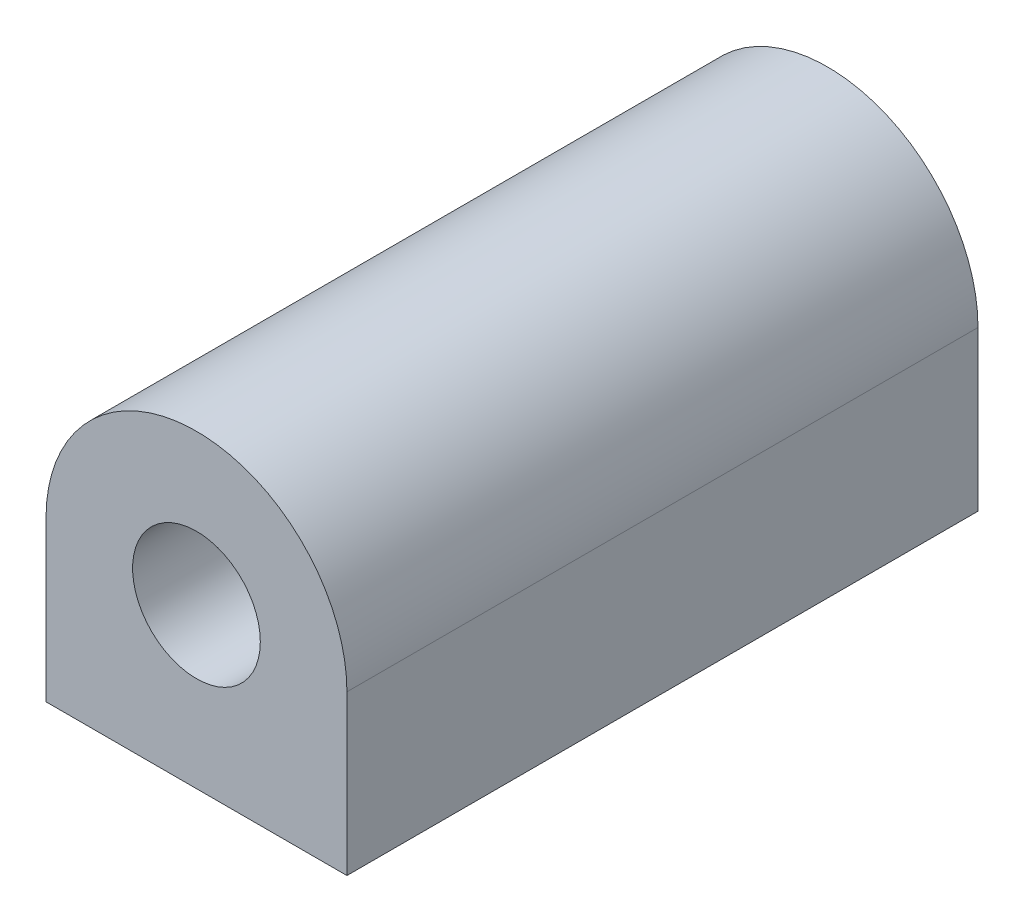
from build123d import *

# Parameters (mm, degrees)
SKETCH2_R           = 3.475
BOSS_EXTRUDE2_DEPTH = 14.575
SKETCH3_R           = 1.475
CUT_EXTRUDE1_DEPTH  = 10
CUT_EXTRUDE2_START  = -10
SKETCH4_R           = 1.475
CUT_EXTRUDE2_DEPTH  = 10
BOSS_EXTRUDE3_DEPTH = 14.575
SKETCH6_W           = 6.95
SKETCH6_H           = 14.575
BOSS_EXTRUDE4_DEPTH = 0.2


with BuildPart() as part:
    # Sketch2 → Boss-Extrude2 (new body)
    with BuildSketch(Plane.XY):
        Circle(SKETCH2_R)
    extrude(amount=BOSS_EXTRUDE2_DEPTH)

    # Sketch3 → Cut-Extrude1 (cut)
    with BuildSketch(Plane.XY.offset(14.575)):
        Circle(SKETCH3_R)
    extrude(amount=-CUT_EXTRUDE1_DEPTH, mode=Mode.SUBTRACT)

    # Sketch4 → Cut-Extrude2 (cut)
    with BuildSketch(Plane(origin=(0, 0, 0), x_dir=(-1, 0, 0), z_dir=(0, 0, -1)).offset(CUT_EXTRUDE2_START)):
        with Locations(Location((0, 0, 0), (0, 0, 180))):
            Circle(SKETCH4_R)
    extrude(amount=CUT_EXTRUDE2_DEPTH, mode=Mode.SUBTRACT)

    # Sketch5 → Boss-Extrude3 (add)
    with BuildSketch(Plane(origin=(0, 0, 0), x_dir=(-1, 0, 0), z_dir=(0, 0, -1))):
        with BuildLine():
            ThreePointArc((0, -3.475), (-2.457196065, -2.457196065), (-3.475, 0))
            Line((-3.475, 0), (-3.475, -3.475))
            Line((-3.475, -3.475), (0, -3.475))
        make_face()
        with BuildLine():
            Line((3.475, -3.475), (3.475, 0))
            ThreePointArc((3.475, 0), (2.457196065, -2.457196065), (0, -3.475))
            Line((0, -3.475), (3.475, -3.475))
        make_face()
    extrude(amount=-BOSS_EXTRUDE3_DEPTH)

    # Sketch6 → Boss-Extrude4 (add)
    with BuildSketch(Plane.XZ.offset(3.475)):
        with Locations((0, 7.2875)):
            Rectangle(SKETCH6_W, SKETCH6_H)
    extrude(amount=BOSS_EXTRUDE4_DEPTH)


solid = part.part
